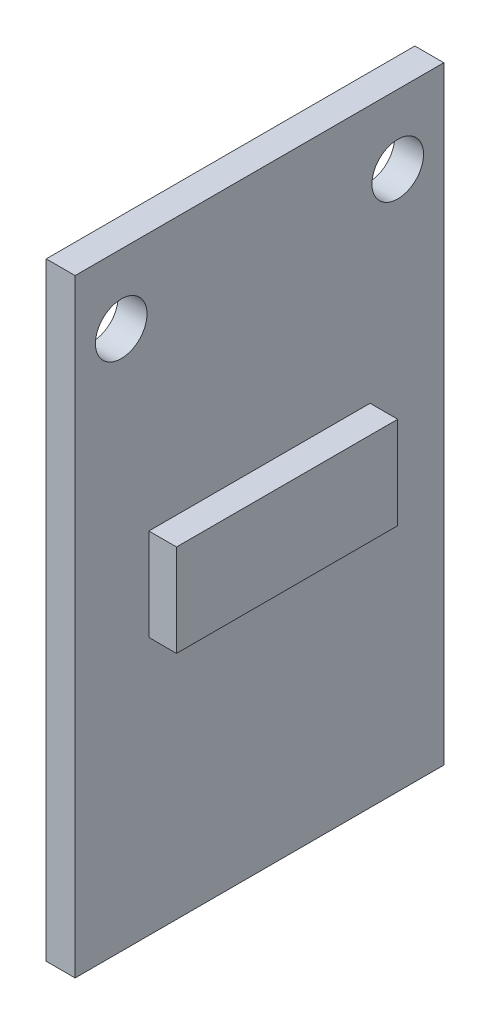
from build123d import *

# Parameters (mm, degrees)
SKETCH1_W           = 33
SKETCH1_H           = 20
SKETCH1_R           = 1.4
BOSS_EXTRUDE1_DEPTH = 1.57
SKETCH2_W           = 5
SKETCH2_H           = 12
BOSS_EXTRUDE2_DEPTH = 1.5


with BuildPart() as part:
    # Sketch1 → Boss-Extrude1 (new body)
    with BuildSketch(Plane.YZ):
        Rectangle(SKETCH1_W, SKETCH1_H)
        with Locations(Location((12.75, 7.5, 0), (0, 0, 270))):
            Circle(SKETCH1_R, mode=Mode.SUBTRACT)
        with Locations(Location((12.75, -7.5, 0), (0, 0, 270))):
            Circle(SKETCH1_R, mode=Mode.SUBTRACT)
    extrude(amount=BOSS_EXTRUDE1_DEPTH)

    # Sketch2 → Boss-Extrude2 (add)
    with BuildSketch(Plane.YZ.offset(1.57)):
        Rectangle(SKETCH2_W, SKETCH2_H)
    extrude(amount=BOSS_EXTRUDE2_DEPTH)


solid = part.part
